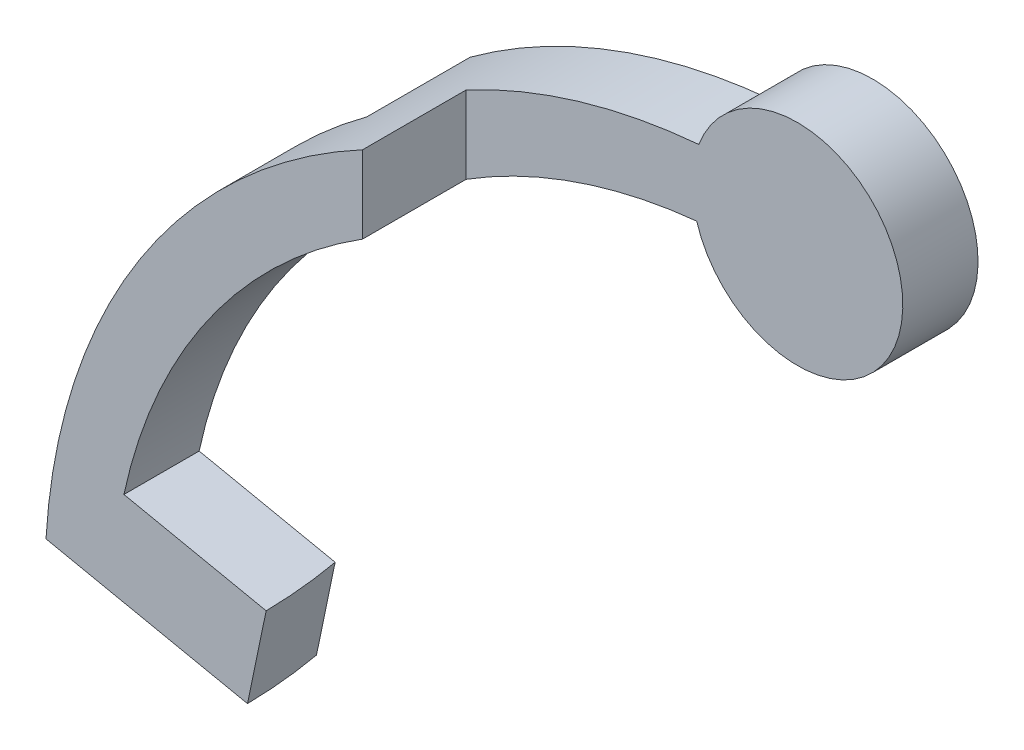
from build123d import *

# Parameters (mm, degrees)
BOSS_EXTRU_2_DEPTH           = 5
BOSS_EXTRU_3_DEPTH           = 45
ENL_V_MAT_EXTRU_3_DEPTH      = 5
ENL_V_MAT_EXTRU_3_DEPTH_BACK = 73.880031702
ESQUISSE4_4_W                = 16.307493561
ESQUISSE4_4_H                = 6.882073419
ENL_V_MAT_EXTRU_4_DEPTH      = 59.546414832
ENL_V_MAT_EXTRU_6_DEPTH      = 58.197243994


with BuildPart() as part:
    # Esquisse3 → Boss.-Extru.2 (new body)
    with BuildSketch(Plane.XY):
        with BuildLine():
            ThreePointArc((7, 0), (1.246257582, 6.888166813), (-6.556240583, 2.452694319))
            ThreePointArc((-6.556240583, 2.452694319), (-6.99644453, 0.22307834), (-6.699170831, -2.030051767))
            ThreePointArc((-6.699170831, -2.030051767), (1.026110175, -6.924384298), (7, 0))
        make_face()
    extrude(amount=BOSS_EXTRU_2_DEPTH)

    # Esquisse3<3> → Boss.-Extru.3 (add)
    with BuildSketch(Plane.XY):
        with BuildLine():
            ThreePointArc((-6.556240583, 2.452694319), (-31.795381091, -9.503990443), (-43.059714875, -35.059641647))
            Line((-43.059714875, -35.059641647), (-29.67043681, -37.846531887))
            Line((-29.67043681, -37.846531887), (-28.42882324, -31.881349224))
            Line((-28.42882324, -31.881349224), (-37.880972605, -29.913946449))
            ThreePointArc((-37.880972605, -29.913946449), (-26.825365644, -10.900303142), (-6.699170831, -2.030051767))
            ThreePointArc((-6.699170831, -2.030051767), (-6.99644453, 0.22307834), (-6.556240583, 2.452694319))
        make_face()
    extrude(amount=BOSS_EXTRU_3_DEPTH)

    # Esquisse4 → Enlèv. mat.-Extru.3 (cut, two sides: drawn at the far end of the back side and taken through both)
    with BuildSketch(Plane(origin=(0, 0, 0), x_dir=(1, 0, 0), z_dir=(0, 1, 0)).offset(-ENL_V_MAT_EXTRU_3_DEPTH_BACK)):
        Polygon((-6.556240583, -21.643777245), (-6.556240583, -5), (-22.02118604, -5), (-22.02118604, -11.882073419), (-43.059714875, -11.882073419), (-43.059714875, -11.918484986), (-43.059714875, -45), (-43.059714875, -53.527020644), (-6.425184121, -53.527020644), align=None)
    extrude(amount=ENL_V_MAT_EXTRU_3_DEPTH + ENL_V_MAT_EXTRU_3_DEPTH_BACK, mode=Mode.SUBTRACT)

    # Esquisse4<4> → Enlèv. mat.-Extru.4 (cut, through all)
    with BuildSketch(Plane(origin=(0, 0, 0), x_dir=(1, 0, 0), z_dir=(0, 1, 0))):
        with Locations((-34.905968095, -3.44103671)):
            Rectangle(ESQUISSE4_4_W, ESQUISSE4_4_H)
    extrude(amount=-ENL_V_MAT_EXTRU_4_DEPTH, mode=Mode.SUBTRACT)

    # Esquisse5 → Enlèv. mat.-Extru.6 (cut, through all)
    with BuildSketch(Plane(origin=(-7.540837864, -36.229046112, 0), x_dir=(0.9790175257089632, -0.2037760642340011, 0), z_dir=(0.2037760642340011, 0.9790175257089632, 0))):
        with BuildLine():
            Line((-21.759079286, -6.882073419), (-21.33566032, -6.882073419))
            Line((-21.33566032, -6.882073419), (-21.33566032, -11.882073419))
            ThreePointArc((-21.33566032, -11.882073419), (-21.456922238, -9.374413977), (-21.759079286, -6.882073419))
        make_face()
    extrude(amount=-ENL_V_MAT_EXTRU_6_DEPTH, mode=Mode.SUBTRACT)


solid = part.part
